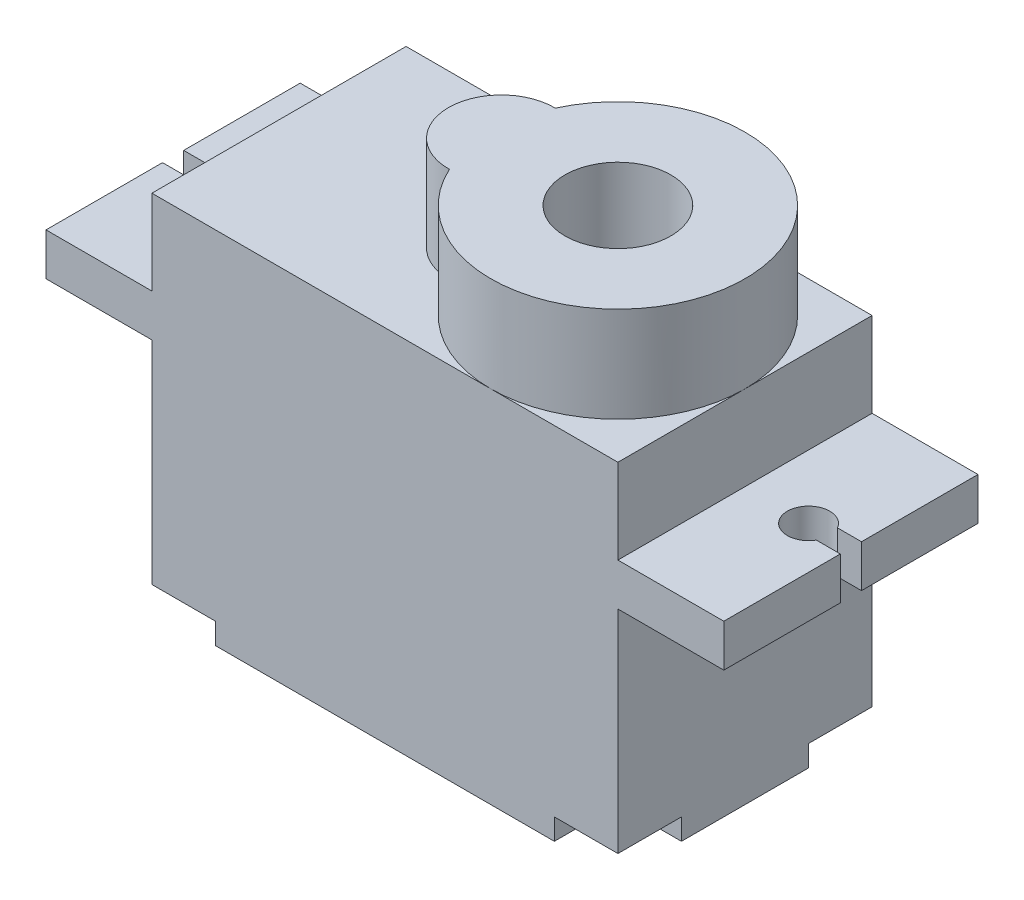
from build123d import *

# Parameters (mm, degrees)
CROQUIS1_W              = 22
CROQUIS1_H              = 12
SALIENTE_EXTRUIR1_DEPTH = 11
CROQUIS3_W              = 10
CROQUIS3_H              = 12
SALIENTE_EXTRUIR2_DEPTH = 2
CROQUIS4_W              = 12
CROQUIS4_H              = 12
SALIENTE_EXTRUIR3_DEPTH = 6
CORTAR_EXTRUIR1_DEPTH   = 2
CROQUIS6_W              = 5
CROQUIS6_H              = 12
SALIENTE_EXTRUIR4_DEPTH = 4
CORTAR_EXTRUIR2_DEPTH   = 4
CROQUIS8_R              = 6
SALIENTE_EXTRUIR5_DEPTH = 4.5
SALIENTE_EXTRUIR6_DEPTH = 4.5
CROQUIS10_W             = 3
CROQUIS10_H             = 3
CORTAR_EXTRUIR3_DEPTH   = 1
REDONDEO1_R             = 1.5
CROQUIS11_W             = 3
CROQUIS11_H             = 3
CORTAR_EXTRUIR4_DEPTH   = 1
REDONDEO3_R             = 1.5
CROQUIS12_R             = 1
CORTAR_EXTRUIR5_DEPTH   = 3
CROQUIS13_R             = 2.5
CORTAR_EXTRUIR6_DEPTH   = 5


with BuildPart() as part:
    # Croquis1 → Saliente-Extruir1 (new body)
    with BuildSketch(Plane(origin=(0, 0, 0), x_dir=(1, 0, 0), z_dir=(0, 1, 0))):
        Rectangle(CROQUIS1_W, CROQUIS1_H)
    extrude(amount=SALIENTE_EXTRUIR1_DEPTH)

    # Croquis3 → Saliente-Extruir2 (add)
    with BuildSketch(Plane(origin=(0, 11, 0), x_dir=(1, 0, 0), z_dir=(0, 1, 0))):
        with Locations((-11, 0)):
            Rectangle(CROQUIS3_W, CROQUIS3_H)
        with Locations((11, 0)):
            Rectangle(CROQUIS3_W, CROQUIS3_H)
    extrude(amount=SALIENTE_EXTRUIR2_DEPTH)

    # Croquis4 → Saliente-Extruir3 (add)
    with BuildSketch(Plane(origin=(0, 11, 0), x_dir=(1, 0, 0), z_dir=(0, 1, 0))):
        Rectangle(CROQUIS4_W, CROQUIS4_H)
    extrude(amount=SALIENTE_EXTRUIR3_DEPTH)

    # Croquis5 → Cortar-Extruir1 (cut)
    with BuildSketch(Plane(origin=(0, 13, 0), x_dir=(1, 0, 0), z_dir=(0, 1, 0))):
        with BuildLine():
            Line((-16, 0), (-16, 0.5))
            Line((-16, 0.5), (-15, 0.5))
            Line((-15, 0.5), (-14.866025404, 0.5))
            ThreePointArc((-14.866025404, 0.5), (-13, 0), (-14.866025404, -0.5))
            Line((-14.866025404, -0.5), (-15, -0.5))
            Line((-15, -0.5), (-15.911665796, -0.5))
            Line((-15.911665796, -0.5), (-16, -0.5))
            Line((-16, -0.5), (-16, 0))
        make_face()
    extrude(amount=-CORTAR_EXTRUIR1_DEPTH, mode=Mode.SUBTRACT)

    # Croquis6 → Saliente-Extruir4 (add)
    with BuildSketch(Plane(origin=(0, 13, 0), x_dir=(1, 0, 0), z_dir=(0, 1, 0))):
        with Locations((-8.5, 0)):
            Rectangle(CROQUIS6_W, CROQUIS6_H)
        with Locations((8.5, 0)):
            Rectangle(CROQUIS6_W, CROQUIS6_H)
    extrude(amount=SALIENTE_EXTRUIR4_DEPTH)

    # Croquis7 → Cortar-Extruir2 (cut)
    with BuildSketch(Plane(origin=(0, 13, 0), x_dir=(1, 0, 0), z_dir=(0, 1, 0))):
        with BuildLine():
            Line((16, 0), (16, 0.5))
            Line((16, 0.5), (14.906951689, 0.5))
            Line((14.906951689, 0.5), (14.866025404, 0.5))
            ThreePointArc((14.866025404, 0.5), (13, 0), (14.866025404, -0.5))
            Line((14.866025404, -0.5), (15, -0.5))
            Line((15, -0.5), (16, -0.5))
            Line((16, -0.5), (16, 0))
        make_face()
    extrude(amount=-CORTAR_EXTRUIR2_DEPTH, mode=Mode.SUBTRACT)

    # Croquis8 → Saliente-Extruir5 (add)
    with BuildSketch(Plane(origin=(0, 17, 0), x_dir=(1, 0, 0), z_dir=(0, 1, 0))):
        with Locations(Location((5, 0, 0), (0, 0, 270))):
            Circle(CROQUIS8_R)
    extrude(amount=SALIENTE_EXTRUIR5_DEPTH)

    # Croquis9 → Saliente-Extruir6 (add)
    with BuildSketch(Plane(origin=(0, 17, 0), x_dir=(1, 0, 0), z_dir=(0, 1, 0))):
        with BuildLine():
            ThreePointArc((-0.454545455, -2.499586743), (-1, 0), (-0.454545455, 2.499586743))
            ThreePointArc((-0.454545455, 2.499586743), (-3, 0), (-0.454545455, -2.499586743))
        make_face()
    extrude(amount=SALIENTE_EXTRUIR6_DEPTH)

    # Croquis10 → Cortar-Extruir3 (cut)
    with BuildSketch(Plane(origin=(0, 0, 0), x_dir=(-1, 0, 0), z_dir=(0, -1, 0))):
        with Locations((9.5, -4.5)):
            Rectangle(CROQUIS10_W, CROQUIS10_H)
    extrude(amount=-CORTAR_EXTRUIR3_DEPTH, mode=Mode.SUBTRACT)

    # Redondeo1
    redondeo1_edges = [part.edges().sort_by_distance(p)[0] for p in [
        (-8, 0.5, 3),
    ]]
    fillet(redondeo1_edges, radius=REDONDEO1_R)

    # Croquis11 → Cortar-Extruir4 (cut)
    with BuildSketch(Plane(origin=(0, 0, 0), x_dir=(-1, 0, 0), z_dir=(0, -1, 0))):
        with Locations((9.5, 4.5)):
            Rectangle(CROQUIS11_W, CROQUIS11_H)
        with Locations((-9.5, -4.5)):
            Rectangle(CROQUIS11_W, CROQUIS11_H)
        with Locations((-9.5, 4.5)):
            Rectangle(CROQUIS11_W, CROQUIS11_H)
    extrude(amount=-CORTAR_EXTRUIR4_DEPTH, mode=Mode.SUBTRACT)

    # Redondeo3
    redondeo3_edges = [part.edges().sort_by_distance(p)[0] for p in [
        (-8, 0.5, -3),
        (8, 0.5, 3),
        (8, 0.5, -3),
    ]]
    fillet(redondeo3_edges, radius=REDONDEO3_R)

    # Croquis12 → Cortar-Extruir5 (cut)
    with BuildSketch(Plane(origin=(0, 1, 0), x_dir=(-1, 0, 0), z_dir=(0, -1, 0))):
        with Locations(Location((9.75, -4.75, 0), (0, 0, 90))):
            Circle(CROQUIS12_R)
        with Locations(Location((9.75, 4.75, 0), (0, 0, 90))):
            Circle(CROQUIS12_R)
        with Locations(Location((-9.75, -4.75, 0), (0, 0, 90))):
            Circle(CROQUIS12_R)
        with Locations(Location((-9.75, 4.75, 0), (0, 0, 90))):
            Circle(CROQUIS12_R)
    extrude(amount=-CORTAR_EXTRUIR5_DEPTH, mode=Mode.SUBTRACT)

    # Croquis13 → Cortar-Extruir6 (cut)
    with BuildSketch(Plane(origin=(0, 21.5, 0), x_dir=(1, 0, 0), z_dir=(0, 1, 0))):
        with Locations(Location((5, 0, 0), (0, 0, 270))):
            Circle(CROQUIS13_R)
    extrude(amount=-CORTAR_EXTRUIR6_DEPTH, mode=Mode.SUBTRACT)


solid = part.part
